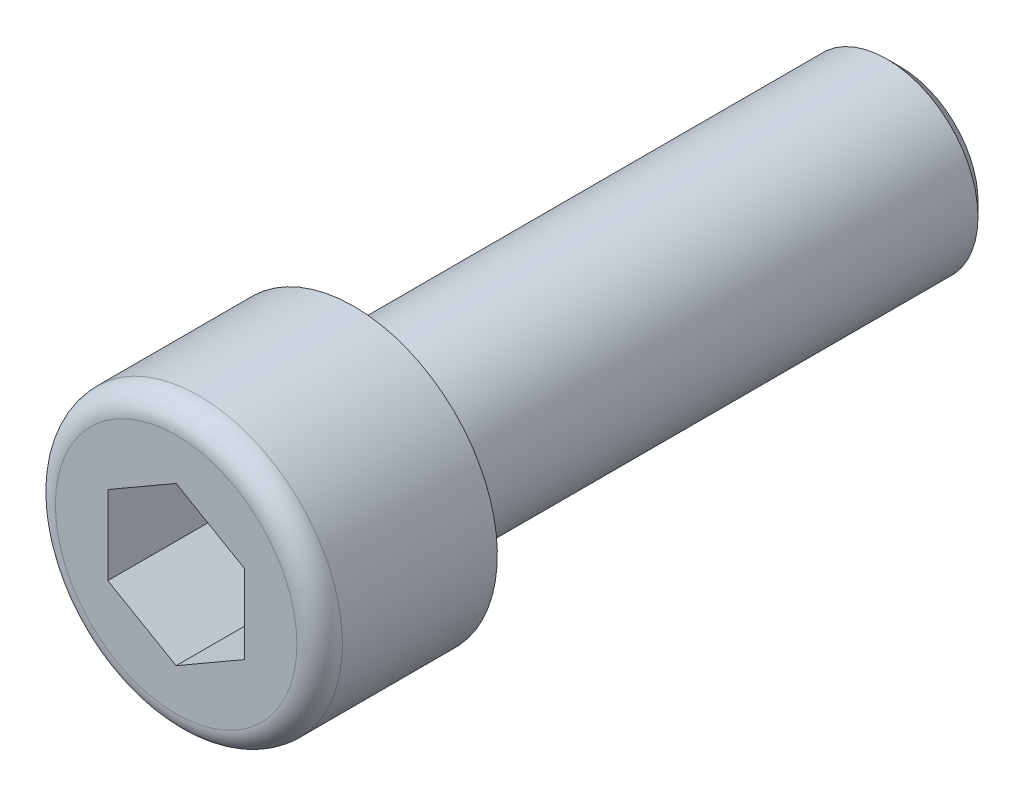
from build123d import *

# Parameters (mm, degrees)
CUT_EXTRUDE_1_DEPTH = 2.5
FILLET_1_R          = 0.5
CHAMFER_1_SIZE      = 0.3


with BuildPart() as part:
    # 草图1 → 旋转1 (revolve)
    with BuildSketch(Plane(origin=(0, 0, 0), x_dir=(0, 0, -1), z_dir=(1, 0, 0))):
        Polygon((-7.95, 0), (-7.95, 3.15), (-4.05, 3.15), (-4.05, 2), (7.95, 2), (7.95, 0), align=None)
    revolve(axis=Axis((0, 0, -7.95), (0, 0, 1)))

    # 草图2 → 切除-拉伸1 (cut)
    with BuildSketch(Plane.XY.offset(7.95)):
        Polygon((0, 1.732050808), (-1.5, 0.866025404), (-1.5, -0.866025404), (0, -1.732050808), (1.5, -0.866025404), (1.5, 0.866025404), align=None)
    extrude(amount=-CUT_EXTRUDE_1_DEPTH, mode=Mode.SUBTRACT)

    # 圆角1
    fillet_1_edges = [part.edges().sort_by_distance(p)[0] for p in [
        (0, -3.15, 7.95),
    ]]
    fillet(fillet_1_edges, radius=FILLET_1_R)

    # 倒角1
    chamfer_1_edges = [part.edges().sort_by_distance(p)[0] for p in [
        (0, -2, -7.95),
    ]]
    chamfer(chamfer_1_edges, length=CHAMFER_1_SIZE)


solid = part.part
